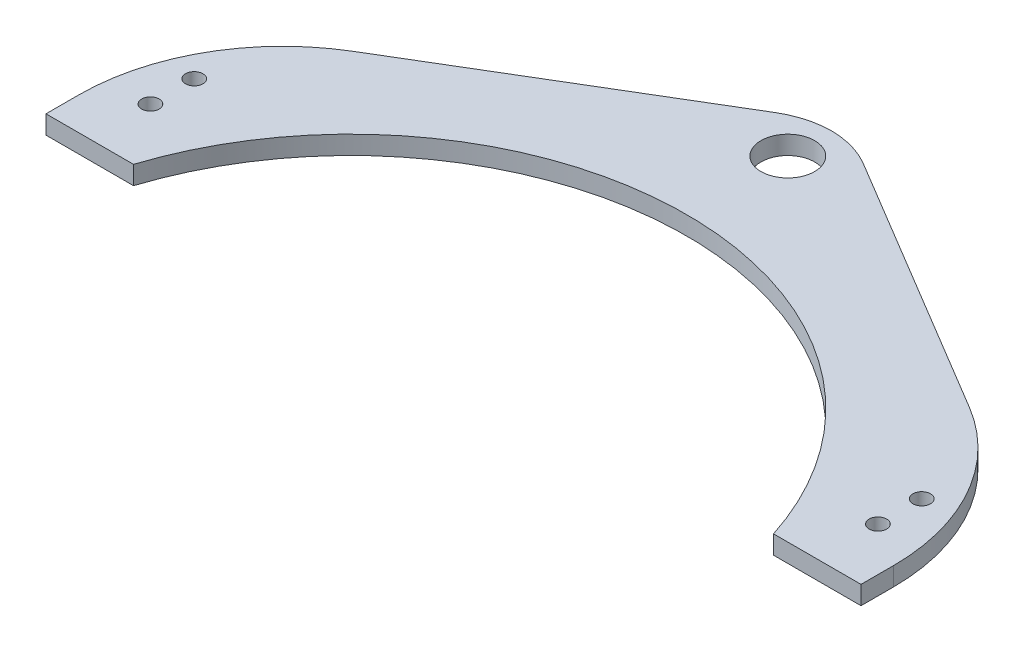
from build123d import *

# Parameters (mm, degrees)
SKETCH1_R           = 4.6
SKETCH1_R_2         = 1.5
BOSS_EXTRUDE2_DEPTH = 3.175


with BuildPart() as part:
    # Sketch1 → Boss-Extrude2 (new body)
    with BuildSketch(Plane(origin=(0, 0, 0), x_dir=(1, 0, 0), z_dir=(0, 1, 0))):
        with BuildLine():
            Line((109.700000056, 0), (117.200000056, 0))
            Line((117.200000056, 0), (124.700000056, 0))
            Line((124.700000056, 0), (124.700000056, 5.554920326))
            ThreePointArc((124.700000056, 5.554920326), (120.146392707, 22.818094267), (107.670447225, 35.589284453))
            Line((107.670447225, 35.589284453), (62.40678526, 62.67187034))
            ThreePointArc((62.40678526, 62.67187034), (58.77003956, 64.238725538), (54.850000028, 64.799300745))
            ThreePointArc((54.850000028, 64.799300745), (50.929960496, 64.238725538), (47.293214796, 62.67187034))
            Line((47.293214796, 62.67187034), (2.029552831, 35.589284453))
            ThreePointArc((2.029552831, 35.589284453), (-10.446392651, 22.818094267), (-15, 5.554920326))
            Line((-15, 5.554920326), (-15, 0))
            Line((-15, 0), (-7.5, 0))
            Line((-7.5, 0), (0, 0))
            ThreePointArc((0, 0), (54.850000028, 39.949878845), (109.700000056, 0))
        make_face()
        with Locations(Location((54.850000028, 57.3, 0), (0, 0, 270))):
            Circle(SKETCH1_R, mode=Mode.SUBTRACT)
        with BuildLine():
            ThreePointArc((117.200000056, 8.9), (115.700000056, 10.4), (117.200000056, 11.9))
            ThreePointArc((117.200000056, 11.9), (118.700000056, 10.4), (117.200000056, 8.9))
        make_face(mode=Mode.SUBTRACT)
        with Locations(Location((117.200000056, 17.9, 0), (0, 0, 270))):
            Circle(SKETCH1_R_2, mode=Mode.SUBTRACT)
        with BuildLine():
            ThreePointArc((-7.5, 8.9), (-9, 10.4), (-7.5, 11.9))
            ThreePointArc((-7.5, 11.9), (-6, 10.4), (-7.5, 8.9))
        make_face(mode=Mode.SUBTRACT)
        with Locations(Location((-7.5, 17.9, 0), (0, 0, 270))):
            Circle(SKETCH1_R_2, mode=Mode.SUBTRACT)
    extrude(amount=BOSS_EXTRUDE2_DEPTH)


solid = part.part
